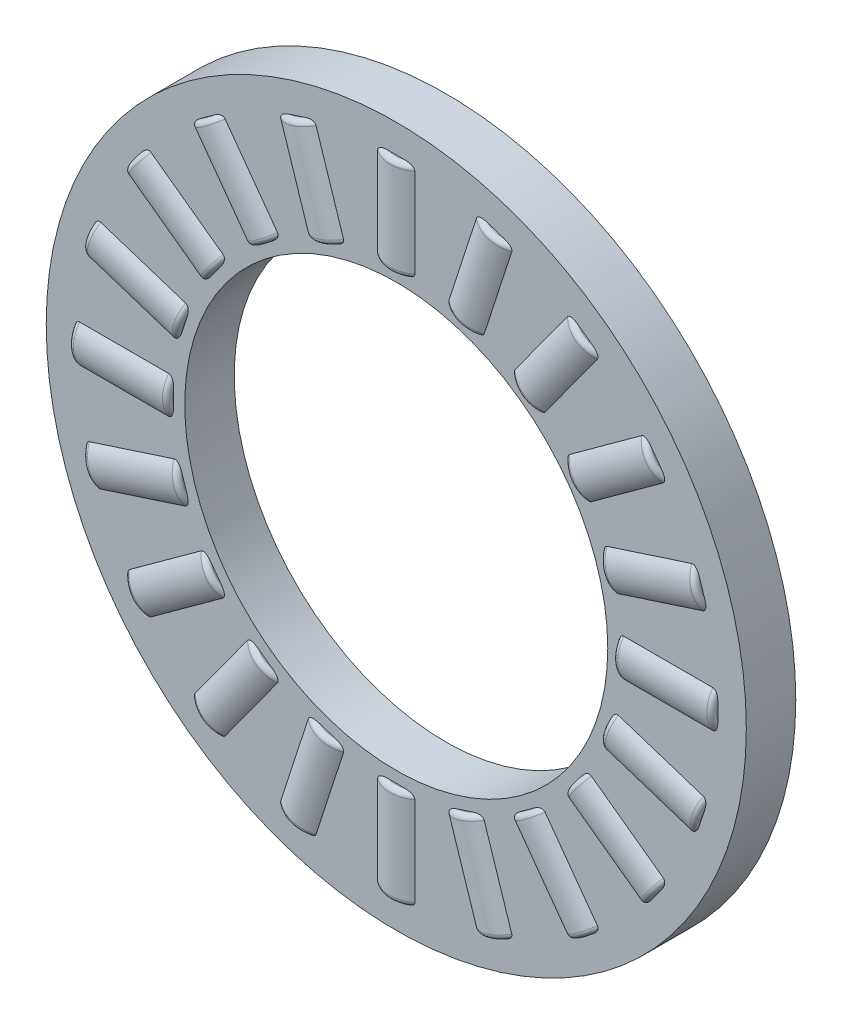
from build123d import *

# Parameters (mm, degrees)
SKETCH1_W         = 2
SKETCH1_H         = 5.6
CIRPATTERN1_COUNT = 20


with BuildPart() as part:
    # Sketch1 → Revolve1 (revolve)
    with BuildSketch(Plane(origin=(0, 0, 0), x_dir=(0, 0, -1), z_dir=(1, 0, 0)), mode=Mode.PRIVATE) as revolve1_sk:
        with Locations((0, 11.35)):
            Rectangle(SKETCH1_W, SKETCH1_H)
    revolve(revolve1_sk.sketch.rotate(Axis((0, 0, 0), (0, 0, -1)), 90), axis=Axis((0, 0, 0), (0, 0, -1)))

    # Sketch2 → Revolve2 (revolve)
    with BuildSketch(Plane(origin=(0, 0, 0), x_dir=(0, 0, -1), z_dir=(1, 0, 0))):
        with BuildLine():
            Line((0, 13), (1.05, 13))
            ThreePointArc((1.05, 13), (1.191421356, 12.941421356), (1.25, 12.8))
            Line((1.25, 12.8), (1.25, 9.2))
            ThreePointArc((1.25, 9.2), (1.191421356, 9.058578644), (1.05, 9))
            Line((1.05, 9), (0, 9))
            Line((0, 9), (0, 13))
        make_face()
    revolve2 = revolve(axis=Axis((0, 0, 0), (0, 1, 0)))

    # CirPattern1: Revolve2 ×20 about axis
    cirpattern1_axis = Axis((0, 0, 0), (0, 0, 1))
    for i in range(1, CIRPATTERN1_COUNT):
        add(revolve2.rotate(cirpattern1_axis, i * 360 / CIRPATTERN1_COUNT))


solid = part.part
